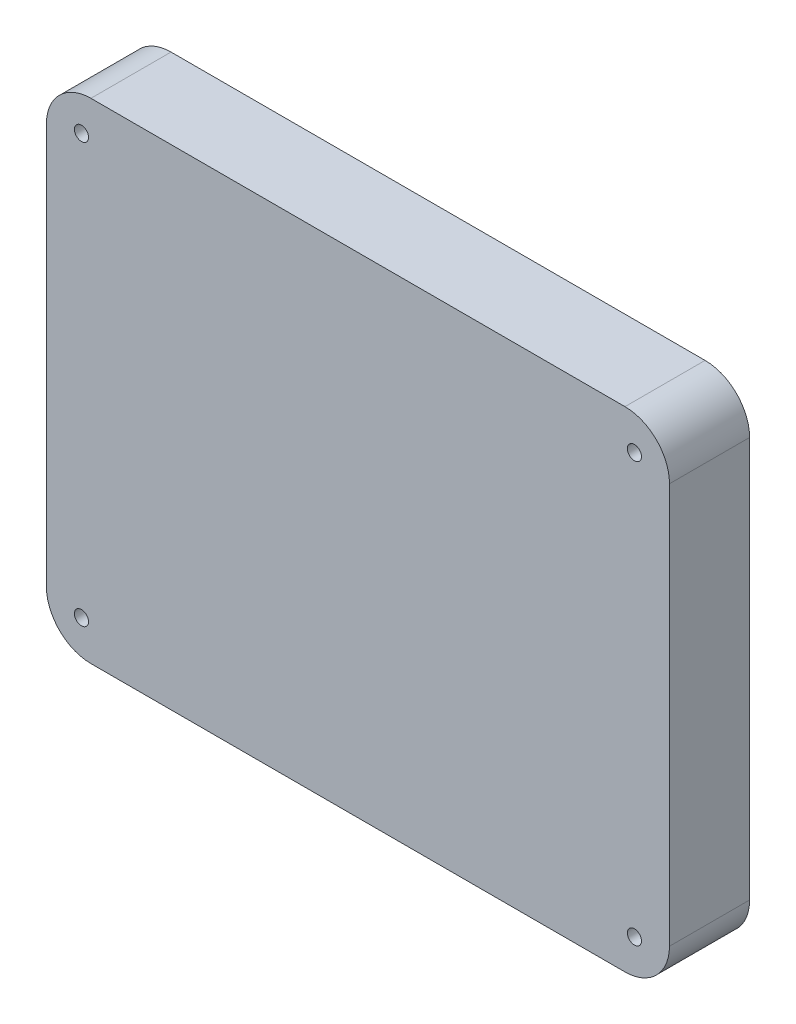
from build123d import *

# Parameters (mm, degrees)
BOSS_EXTRUDE1_DEPTH = 18
SKETCH2_R           = 1.5875
CUT_EXTRUDE1_DEPTH  = 30


with BuildPart() as part:
    # Sketch1 → Boss-Extrude1 (new body)
    with BuildSketch(Plane.XY):
        with BuildLine():
            Line((109.99935, 90), (-10.00065, 90))
            ThreePointArc((-10.00065, 90), (-17.071717812, 87.071067812), (-20.00065, 80))
            Line((-20.00065, 80), (-20.00065, -10))
            ThreePointArc((-20.00065, -10), (-17.071717812, -17.071067812), (-10.00065, -20))
            Line((-10.00065, -20), (109.99935, -20))
            ThreePointArc((109.99935, -20), (117.070417812, -17.071067812), (119.99935, -10))
            Line((119.99935, -10), (119.99935, 80))
            ThreePointArc((119.99935, 80), (117.070417812, 87.071067812), (109.99935, 90))
        make_face()
    extrude(amount=BOSS_EXTRUDE1_DEPTH)

    # Sketch2 → Cut-Extrude1 (cut)
    with BuildSketch(Plane.XY.offset(18)):
        with Locations((-12.121970344, 82.121320344)):
            Circle(SKETCH2_R)
        with Locations((-12.121970344, -12.121320344)):
            Circle(SKETCH2_R)
        with Locations((112.120670344, 82.121320344)):
            Circle(SKETCH2_R)
        with Locations((112.120670344, -12.121320344)):
            Circle(SKETCH2_R)
    extrude(amount=-CUT_EXTRUDE1_DEPTH, mode=Mode.SUBTRACT)


solid = part.part
